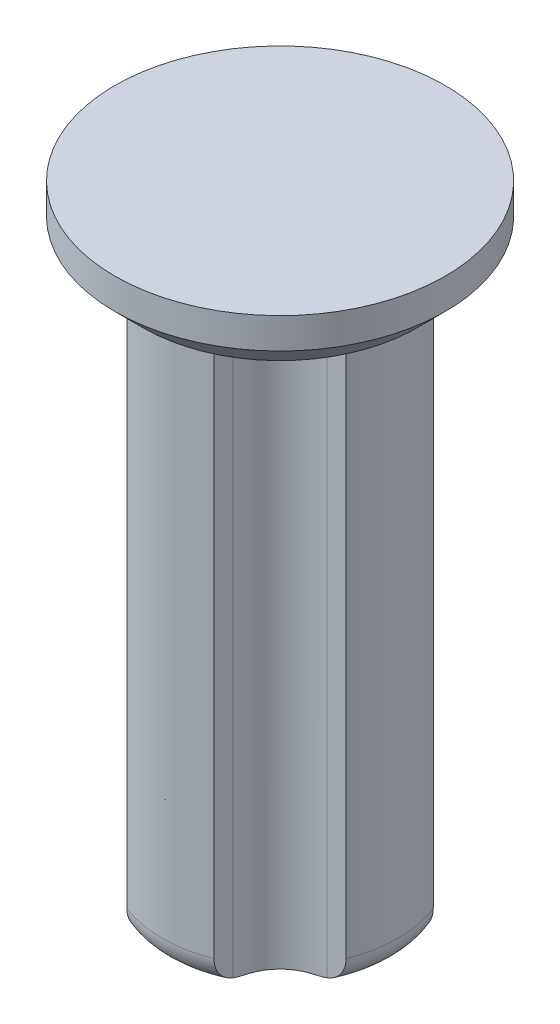
from build123d import *

# Parameters (mm, degrees)
SKETCH1_R           = 2.2225
BOSS_EXTRUDE1_DEPTH = 0.79375
SKETCH2_R           = 1.5875
BOSS_EXTRUDE2_DEPTH = 7.62
CUT_EXTRUDE2_START  = -7.62
CUT_EXTRUDE2_DEPTH  = 7.62
FILLET1_R           = 0.635
FILLET2_R           = 0.381
CHAMFER1_SIZE       = 0.381


with BuildPart() as part:
    # Sketch1 → Boss-Extrude1 (new body)
    with BuildSketch(Plane(origin=(0, 0, 0), x_dir=(1, 0, 0), z_dir=(0, 1, 0))):
        with Locations(Location((0, 0, 0), (0, 0, 270))):
            Circle(SKETCH1_R)
    extrude(amount=BOSS_EXTRUDE1_DEPTH)

    # Sketch2 → Boss-Extrude2 (add)
    with BuildSketch(Plane.XZ):
        with Locations(Location((0, 0, 0), (0, 0, 90))):
            Circle(SKETCH2_R)
    extrude(amount=BOSS_EXTRUDE2_DEPTH)

    # Sketch3 → Cut-Extrude2 (cut)
    with BuildSketch(Plane.XZ.offset(7.62).offset(CUT_EXTRUDE2_START)):
        with BuildLine():
            Line((-0.586275376, 1.475275376), (-0.586275376, 0.586275376))
            Line((-0.586275376, 0.586275376), (-1.475275376, 0.586275376))
            ThreePointArc((-1.475275376, 0.586275376), (-1.122532015, 1.122532015), (-0.586275376, 1.475275376))
        make_face()
        with BuildLine():
            Line((-1.475275376, -0.586275376), (-0.586275376, -0.586275376))
            Line((-0.586275376, -0.586275376), (-0.586275376, -1.475275376))
            ThreePointArc((-0.586275376, -1.475275376), (-1.122532015, -1.122532015), (-1.475275376, -0.586275376))
        make_face()
        with BuildLine():
            Line((0.586275376, 1.475275376), (0.586275376, 0.586275376))
            Line((0.586275376, 0.586275376), (1.475275376, 0.586275376))
            ThreePointArc((1.475275376, 0.586275376), (1.122532015, 1.122532015), (0.586275376, 1.475275376))
        make_face()
        with BuildLine():
            Line((0.586275376, -1.475275376), (0.586275376, -0.586275376))
            Line((0.586275376, -0.586275376), (1.475275376, -0.586275376))
            ThreePointArc((1.475275376, -0.586275376), (1.122532015, -1.122532015), (0.586275376, -1.475275376))
        make_face()
    extrude(amount=CUT_EXTRUDE2_DEPTH, mode=Mode.SUBTRACT)

    # Fillet1
    fillet1_edges = [part.edges().sort_by_distance(p)[0] for p in [
        (-0.586275376, -3.81, -0.586275376),
        (0.586275376, -3.81, 0.586275376),
        (0.586275376, -3.81, -0.586275376),
        (-0.586275376, -3.81, 0.586275376),
    ]]
    fillet(fillet1_edges, radius=FILLET1_R)

    # Fillet2
    fillet2_edges = [part.edges().sort_by_distance(p)[0] for p in [
        (-1.5875, -7.62, 0),
        (0, -7.62, -1.5875),
        (1.5875, -7.62, 0),
        (0, -7.62, 1.5875),
    ]]
    fillet(fillet2_edges, radius=FILLET2_R)

    # Chamfer1
    chamfer1_edges = [part.edges().sort_by_distance(p)[0] for p in [
        (0, 0, -2.2225),
    ]]
    chamfer(chamfer1_edges, length=CHAMFER1_SIZE)


solid = part.part
